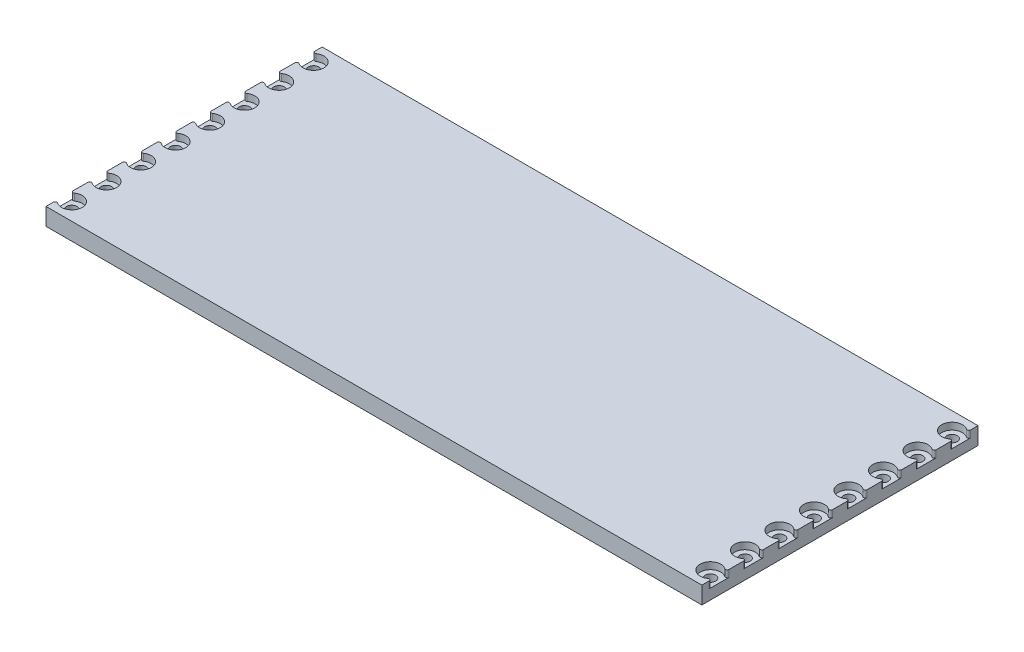
from build123d import *

# Parameters (mm, degrees)
SKETCH3_W           = 190
SKETCH3_H           = 80
BOSS_EXTRUDE1_DEPTH = 5
SKETCH4_R           = 1.5
CUT_EXTRUDE1_DEPTH  = 5
SKETCH5_R           = 3
SKETCH5_R_2         = 1.5
CUT_EXTRUDE2_DEPTH  = 2
FILLET1_R           = 0.5


with BuildPart() as part:
    # Sketch3 → Boss-Extrude1 (new body)
    with BuildSketch(Plane(origin=(0, 0, 0), x_dir=(1, 0, 0), z_dir=(0, 1, 0))):
        Rectangle(SKETCH3_W, SKETCH3_H)
    extrude(amount=BOSS_EXTRUDE1_DEPTH)

    # Sketch4 → Cut-Extrude1 (cut)
    with BuildSketch(Plane(origin=(0, 5, 0), x_dir=(1, 0, 0), z_dir=(0, 1, 0))):
        with Locations(Location((-92.5, 35, 0), (0, 0, 270))):
            Circle(SKETCH4_R)
        with Locations(Location((-92.5, 25, 0), (0, 0, 270))):
            Circle(SKETCH4_R)
        with Locations(Location((-92.5, 15, 0), (0, 0, 270))):
            Circle(SKETCH4_R)
        with Locations(Location((-92.5, 5, 0), (0, 0, 270))):
            Circle(SKETCH4_R)
        with Locations(Location((-92.5, -5, 0), (0, 0, 270))):
            Circle(SKETCH4_R)
        with Locations(Location((-92.5, -15, 0), (0, 0, 270))):
            Circle(SKETCH4_R)
        with Locations(Location((-92.5, -25, 0), (0, 0, 270))):
            Circle(SKETCH4_R)
        with Locations(Location((-92.5, -35, 0), (0, 0, 270))):
            Circle(SKETCH4_R)
        with Locations(Location((92.5, -35, 0), (0, 0, 90))):
            Circle(SKETCH4_R)
        with Locations(Location((92.5, -25, 0), (0, 0, 90))):
            Circle(SKETCH4_R)
        with Locations(Location((92.5, -15, 0), (0, 0, 90))):
            Circle(SKETCH4_R)
        with Locations(Location((92.5, -5, 0), (0, 0, 90))):
            Circle(SKETCH4_R)
        with Locations(Location((92.5, 5, 0), (0, 0, 90))):
            Circle(SKETCH4_R)
        with Locations(Location((92.5, 15, 0), (0, 0, 90))):
            Circle(SKETCH4_R)
        with Locations(Location((92.5, 35, 0), (0, 0, 90))):
            Circle(SKETCH4_R)
        with Locations(Location((92.5, 25, 0), (0, 0, 90))):
            Circle(SKETCH4_R)
    extrude(amount=-CUT_EXTRUDE1_DEPTH, mode=Mode.SUBTRACT)

    # Sketch5 → Cut-Extrude2 (cut)
    # profile 1 of 16: a face of its own
    with BuildSketch(Plane(origin=(0, 5, 0), x_dir=(1, 0, 0), z_dir=(0, 1, 0))):
        with Locations((-92.5, 35)):
            Circle(SKETCH5_R)
        with Locations(Location((-92.5, 35, 0), (0, 0, 270))):
            Circle(SKETCH5_R_2, mode=Mode.SUBTRACT)
    # profile 2 of 16: a face of its own
    with BuildSketch(Plane(origin=(0, 5, 0), x_dir=(1, 0, 0), z_dir=(0, 1, 0))):
        with Locations((92.5, 35)):
            Circle(SKETCH5_R)
        with Locations(Location((92.5, 35, 0), (0, 0, 270))):
            Circle(SKETCH5_R_2, mode=Mode.SUBTRACT)
    # profile 3 of 16: a face of its own
    with BuildSketch(Plane(origin=(0, 5, 0), x_dir=(1, 0, 0), z_dir=(0, 1, 0))):
        with Locations((-92.5, 25)):
            Circle(SKETCH5_R)
    # profile 4 of 16: a face of its own
    with BuildSketch(Plane(origin=(0, 5, 0), x_dir=(1, 0, 0), z_dir=(0, 1, 0))):
        with Locations((92.5, 25)):
            Circle(SKETCH5_R)
    # profile 5 of 16: a face of its own
    with BuildSketch(Plane(origin=(0, 5, 0), x_dir=(1, 0, 0), z_dir=(0, 1, 0))):
        with Locations((-92.5, 15)):
            Circle(SKETCH5_R)
    # profile 6 of 16: a face of its own
    with BuildSketch(Plane(origin=(0, 5, 0), x_dir=(1, 0, 0), z_dir=(0, 1, 0))):
        with Locations((92.5, 15)):
            Circle(SKETCH5_R)
    # profile 7 of 16: a face of its own
    with BuildSketch(Plane(origin=(0, 5, 0), x_dir=(1, 0, 0), z_dir=(0, 1, 0))):
        with Locations((-92.5, 5)):
            Circle(SKETCH5_R)
    # profile 8 of 16: a face of its own
    with BuildSketch(Plane(origin=(0, 5, 0), x_dir=(1, 0, 0), z_dir=(0, 1, 0))):
        with Locations((92.5, 5)):
            Circle(SKETCH5_R)
    # profile 9 of 16: a face of its own
    with BuildSketch(Plane(origin=(0, 5, 0), x_dir=(1, 0, 0), z_dir=(0, 1, 0))):
        with Locations((-92.5, -5)):
            Circle(SKETCH5_R)
    # profile 10 of 16: a face of its own
    with BuildSketch(Plane(origin=(0, 5, 0), x_dir=(1, 0, 0), z_dir=(0, 1, 0))):
        with Locations((92.5, -5)):
            Circle(SKETCH5_R)
    # profile 11 of 16: a face of its own
    with BuildSketch(Plane(origin=(0, 5, 0), x_dir=(1, 0, 0), z_dir=(0, 1, 0))):
        with Locations((-92.5, -15)):
            Circle(SKETCH5_R)
    # profile 12 of 16: a face of its own
    with BuildSketch(Plane(origin=(0, 5, 0), x_dir=(1, 0, 0), z_dir=(0, 1, 0))):
        with Locations((92.5, -15)):
            Circle(SKETCH5_R)
    # profile 13 of 16: a face of its own
    with BuildSketch(Plane(origin=(0, 5, 0), x_dir=(1, 0, 0), z_dir=(0, 1, 0))):
        with Locations((-92.5, -25)):
            Circle(SKETCH5_R)
    # profile 14 of 16: a face of its own
    with BuildSketch(Plane(origin=(0, 5, 0), x_dir=(1, 0, 0), z_dir=(0, 1, 0))):
        with Locations((92.5, -25)):
            Circle(SKETCH5_R)
    # profile 15 of 16: a face of its own
    with BuildSketch(Plane(origin=(0, 5, 0), x_dir=(1, 0, 0), z_dir=(0, 1, 0))):
        with Locations((-92.5, -35)):
            Circle(SKETCH5_R)
    # profile 16 of 16: a face of its own
    with BuildSketch(Plane(origin=(0, 5, 0), x_dir=(1, 0, 0), z_dir=(0, 1, 0))):
        with Locations((92.5, -35)):
            Circle(SKETCH5_R)
    extrude(amount=-CUT_EXTRUDE2_DEPTH, mode=Mode.SUBTRACT)

    # Fillet1
    fillet1_edges = [part.edges().sort_by_distance(p)[0] for p in [
        (-95, 4, -33.341687605),
        (-95, 4, -36.658312395),
        (-95, 4, 26.658312395),
        (-95, 4, 23.341687605),
        (-95, 4, 16.658312395),
        (-95, 4, 13.341687605),
        (-95, 4, 36.658312395),
        (-95, 4, 33.341687605),
        (-95, 4, -13.341687605),
        (-95, 4, -16.658312395),
        (-95, 4, -23.341687605),
        (-95, 4, -26.658312395),
        (-95, 4, 6.658312395),
        (-95, 4, 3.341687605),
        (-95, 4, -3.341687605),
        (-95, 4, -6.658312395),
        (95, 4, 13.341687605),
        (95, 4, 16.658312395),
        (95, 4, 3.341687605),
        (95, 4, 6.658312395),
        (95, 4, 33.341687605),
        (95, 4, 36.658312395),
        (95, 4, 23.341687605),
        (95, 4, 26.658312395),
        (95, 4, -26.658312395),
        (95, 4, -23.341687605),
        (95, 4, -36.658312395),
        (95, 4, -33.341687605),
        (95, 4, -6.658312395),
        (95, 4, -3.341687605),
        (95, 4, -16.658312395),
        (95, 4, -13.341687605),
    ]]
    fillet(fillet1_edges, radius=FILLET1_R)


solid = part.part
